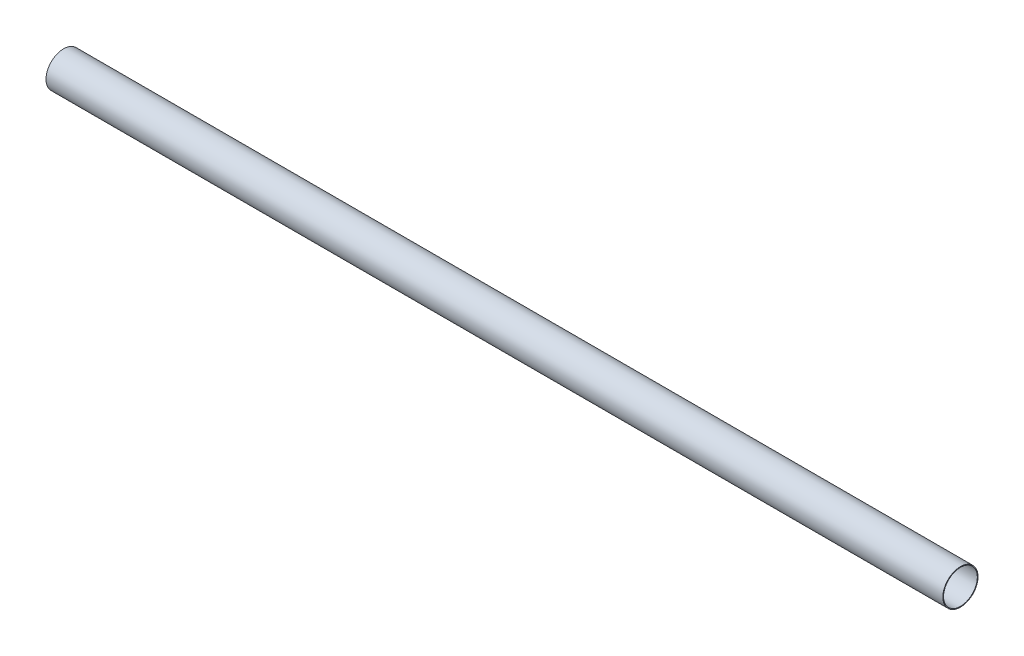
from build123d import *

# Parameters (mm, degrees)
LEG_SLEEVE_SKETCH_W = 800
LEG_SLEEVE_SKETCH_H = 0.65


with BuildPart() as part:
    # Leg_Sleeve Sketch → Leg_Sleeve (revolve)
    with BuildSketch(Plane.XY):
        with Locations((900, 15.375)):
            Rectangle(LEG_SLEEVE_SKETCH_W, LEG_SLEEVE_SKETCH_H)
    revolve(axis=Axis((-3000, 0, 0), (1, 0, 0)))


solid = part.part
